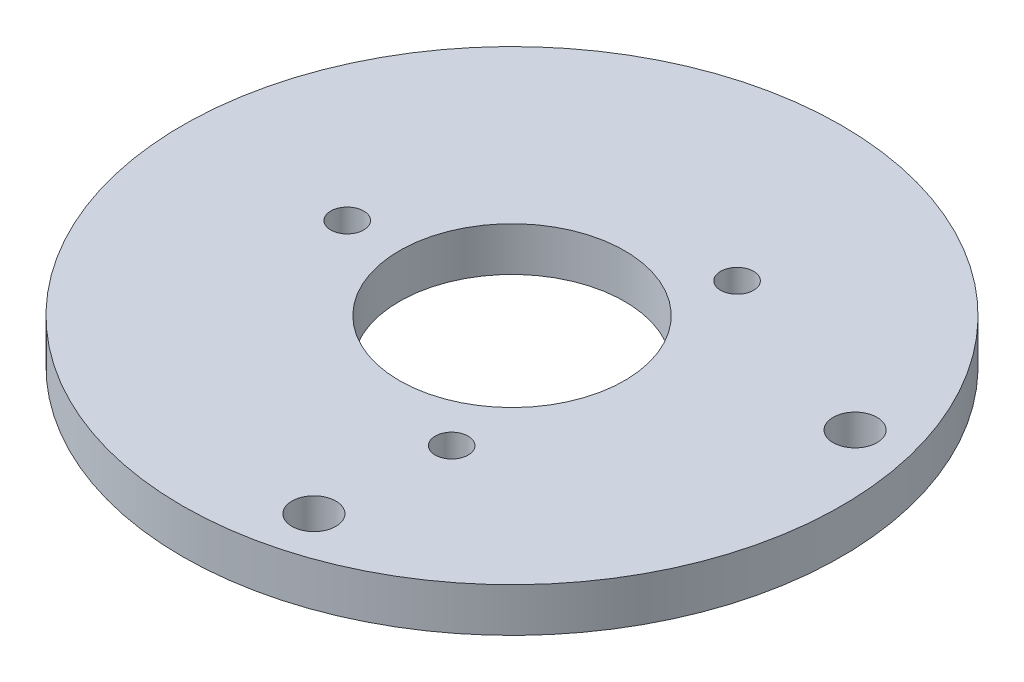
from build123d import *

# Parameters (mm, degrees)
BOSS_EXTRUDE1_DEPTH = 4
SKETCH2_R           = 1.5
CUT_EXTRUDE1_DEPTH  = 4
CIRPATTERN1_COUNT   = 3
SKETCH3_R           = 10.25
CUT_EXTRUDE2_DEPTH  = 4
SKETCH4_R           = 2
CUT_EXTRUDE3_DEPTH  = 4
CIRPATTERN2_COUNT   = 2
CIRPATTERN2_ANGLE   = 90


with BuildPart() as part:
    # Sketch1 → Boss-Extrude1 (new body)
    with BuildSketch(Plane(origin=(0, 0, 0), x_dir=(1, 0, 0), z_dir=(0, 1, 0))):
        with BuildLine():
            ThreePointArc((-30, 0), (0, 30), (30, 0))
            ThreePointArc((30, 0), (0, -30), (-30, 0))
        make_face()
    extrude(amount=BOSS_EXTRUDE1_DEPTH)

    # Sketch2 → Cut-Extrude1 (cut)
    with BuildSketch(Plane(origin=(0, 4, 0), x_dir=(1, 0, 0), z_dir=(0, 1, 0))):
        with Locations(Location((7.5, 12.990381057, 0), (0, 0, 270))):
            Circle(SKETCH2_R)
    cut_extrude1 = extrude(amount=-CUT_EXTRUDE1_DEPTH, mode=Mode.SUBTRACT)

    # CirPattern1: Cut-Extrude1 ×3 about axis
    cirpattern1_axis = Axis((0, 0, 0), (0, 1, 0))
    for i in range(1, CIRPATTERN1_COUNT):
        add(cut_extrude1.rotate(cirpattern1_axis, i * 360 / CIRPATTERN1_COUNT), mode=Mode.SUBTRACT)

    # Sketch3 → Cut-Extrude2 (cut)
    with BuildSketch(Plane(origin=(0, 4, 0), x_dir=(1, 0, 0), z_dir=(0, 1, 0))):
        with Locations(Location((0, 0, 0), (0, 0, 270))):
            Circle(SKETCH3_R)
    extrude(amount=-CUT_EXTRUDE2_DEPTH, mode=Mode.SUBTRACT)

    # Sketch4 → Cut-Extrude3 (cut)
    with BuildSketch(Plane(origin=(0, 4, 0), x_dir=(1, 0, 0), z_dir=(0, 1, 0))):
        with Locations(Location((6.59989, -24.631107405, 0), (0, 0, 270))):
            Circle(SKETCH4_R)
    cut_extrude3 = extrude(amount=-CUT_EXTRUDE3_DEPTH, mode=Mode.SUBTRACT)

    # CirPattern2: Cut-Extrude3 ×2 about axis
    cirpattern2_axis = Axis((0, 4, 0), (0, 1, 0))
    for i in range(1, CIRPATTERN2_COUNT):
        add(cut_extrude3.rotate(cirpattern2_axis, i * CIRPATTERN2_ANGLE / (CIRPATTERN2_COUNT - 1)), mode=Mode.SUBTRACT)


solid = part.part
